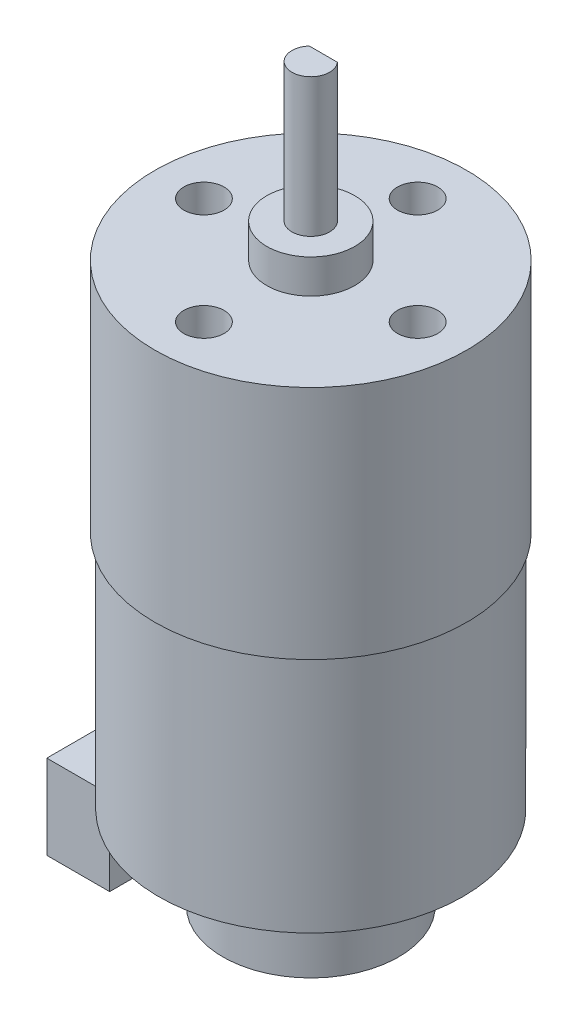
from build123d import *

# Parameters (mm, degrees)
SKETCH_2_R          = 12.1
EXTRUDE_1_DEPTH     = 19.05
EXTRUDE_START       = 19.05
SKETCH_2_3_R        = 12.4
SKETCH_2_3_R_2      = 12.1
SKETCH_2_3_R_3      = 3.5
SKETCH_2_3_R_4      = 1.5
EXTRUDE_2_DEPTH     = 18.75
EXTRUDE_START_2     = 37.8
SKETCH_2_4_R        = 3.5
SKETCH_2_4_R_2      = 1.5
EXTRUDE_3_DEPTH     = 2.7
EXTRUDE_START_3     = 40.5
SKETCH_2_5_R        = 1.5
EXTRUDE_4_DEPTH     = 11
SKETCH_4_R          = 1.6
CUT_EXTRUDE_1_DEPTH = 7
SKETCH_5_W          = 5.123568468
SKETCH_5_H          = 1
CUT_EXTRUDE_2_DEPTH = 8
SKETCH_6_R          = 7
SKETCH_6_W          = 5
SKETCH_6_H          = 14
EXTRUDE_5_DEPTH     = 6.7


with BuildPart() as part:
    # 草图2 → 凸台-拉伸1 (new body)
    with BuildSketch(Plane(origin=(0, 0, 0), x_dir=(1, 0, 0), z_dir=(0, 1, 0))):
        with Locations(Location((0, 0, 0), (0, 0, 90))):
            Circle(SKETCH_2_R)
    extrude(amount=EXTRUDE_1_DEPTH)

    # 草图2<3> → 凸台-拉伸2 (add)
    # profile 1 of 4: a face of its own
    with BuildSketch(Plane(origin=(0, 0, 0), x_dir=(1, 0, 0), z_dir=(0, 1, 0)).offset(EXTRUDE_START)):
        with Locations(Location((0, 0, 0), (0, 0, 270))):
            Circle(SKETCH_2_3_R)
        with Locations(Location((0, 0, 0), (0, 0, 90))):
            Circle(SKETCH_2_3_R_2, mode=Mode.SUBTRACT)
    # profile 2 of 4: a face of its own
    with BuildSketch(Plane(origin=(0, 0, 0), x_dir=(1, 0, 0), z_dir=(0, 1, 0)).offset(EXTRUDE_START)):
        with Locations(Location((0, 0, 0), (0, 0, 90))):
            Circle(SKETCH_2_3_R_2)
        Circle(SKETCH_2_3_R_3, mode=Mode.SUBTRACT)
    # profile 3 of 4: a face of its own
    with BuildSketch(Plane(origin=(0, 0, 0), x_dir=(1, 0, 0), z_dir=(0, 1, 0)).offset(EXTRUDE_START)):
        Circle(SKETCH_2_3_R_3)
        Circle(SKETCH_2_3_R_4, mode=Mode.SUBTRACT)
    # profile 4 of 4: a face of its own
    with BuildSketch(Plane(origin=(0, 0, 0), x_dir=(1, 0, 0), z_dir=(0, 1, 0)).offset(EXTRUDE_START)):
        Circle(SKETCH_2_3_R_4)
    extrude(amount=EXTRUDE_2_DEPTH)

    # 草图2<4> → 凸台-拉伸3 (add)
    # profile 1 of 2: a face of its own
    with BuildSketch(Plane(origin=(0, 0, 0), x_dir=(1, 0, 0), z_dir=(0, 1, 0)).offset(EXTRUDE_START_2)):
        with Locations(Location((0, 0, 0), (0, 0, 90))):
            Circle(SKETCH_2_4_R)
        Circle(SKETCH_2_4_R_2, mode=Mode.SUBTRACT)
    # profile 2 of 2: a face of its own
    with BuildSketch(Plane(origin=(0, 0, 0), x_dir=(1, 0, 0), z_dir=(0, 1, 0)).offset(EXTRUDE_START_2)):
        Circle(SKETCH_2_4_R_2)
    extrude(amount=EXTRUDE_3_DEPTH)

    # 草图2<5> → 凸台-拉伸4 (add)
    with BuildSketch(Plane(origin=(0, 0, 0), x_dir=(1, 0, 0), z_dir=(0, 1, 0)).offset(EXTRUDE_START_3)):
        with Locations(Location((0, 0, 0), (0, 0, 270))):
            Circle(SKETCH_2_5_R)
    extrude(amount=EXTRUDE_4_DEPTH)

    # 草图4 → 切除-拉伸1 (cut)
    with BuildSketch(Plane(origin=(0, 37.8, 0), x_dir=(1, 0, 0), z_dir=(0, 1, 0))):
        with Locations(Location((0, 8.5, 0), (0, 0, 270))):
            Circle(SKETCH_4_R)
        with Locations(Location((8.5, 0, 0), (0, 0, 270))):
            Circle(SKETCH_4_R)
        with Locations(Location((0, -8.5, 0), (0, 0, 270))):
            Circle(SKETCH_4_R)
        with Locations(Location((-8.5, 0, 0), (0, 0, 270))):
            Circle(SKETCH_4_R)
    extrude(amount=-CUT_EXTRUDE_1_DEPTH, mode=Mode.SUBTRACT)

    # 草图5 → 切除-拉伸2 (cut)
    with BuildSketch(Plane(origin=(0, 51.5, 0), x_dir=(1, 0, 0), z_dir=(0, 1, 0))):
        with Locations((0, 1.5)):
            Rectangle(SKETCH_5_W, SKETCH_5_H)
    extrude(amount=-CUT_EXTRUDE_2_DEPTH, mode=Mode.SUBTRACT)

    # 草图6 → 凸台-拉伸5 (add)
    with BuildSketch(Plane.XZ):
        with Locations(Location((0, 0, 0), (0, 0, 270))):
            Circle(SKETCH_6_R)
        with Locations((-11.5, 0)):
            Rectangle(SKETCH_6_W, SKETCH_6_H)
    extrude(amount=EXTRUDE_5_DEPTH)


solid = part.part
